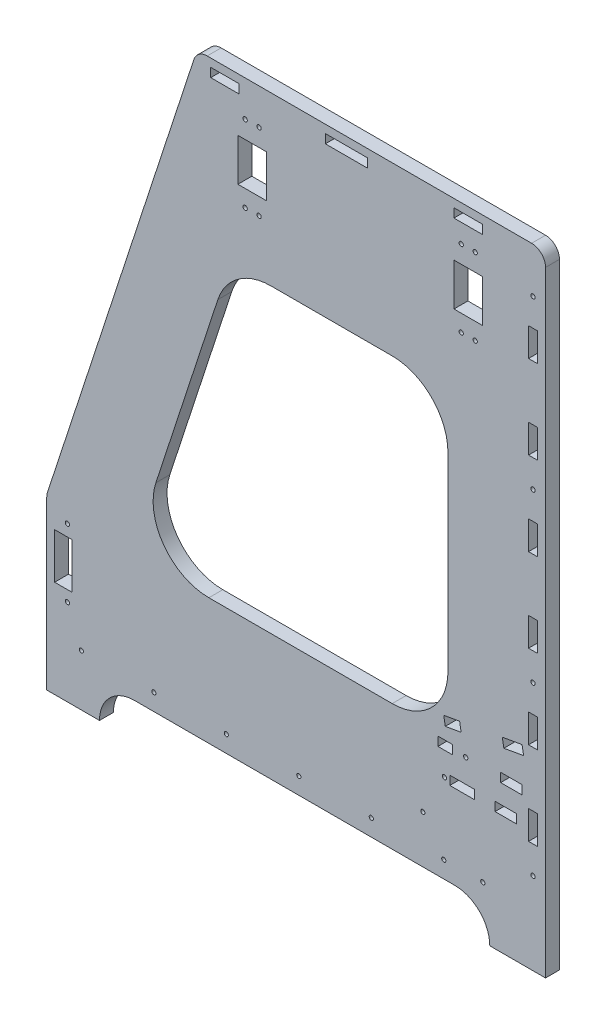
from build123d import *

# Parameters (mm, degrees)
SZKIC1_W                    = 358
SZKIC1_H                    = 451.5
DODANIE_WYCI_GNI_CIE1_DEPTH = 10
WYTNIJ_WYCI_GNI_CIE1_DEPTH  = 10
WYTNIJ_WYCI_GNI_CIE2_DEPTH  = 10
WYTNIJ_WYCI_GNI_CIE3_DEPTH  = 10
SZKIC8_W                    = 6.4
SZKIC8_H                    = 20.4
WYTNIJ_WYCI_GNI_CIE4_DEPTH  = 10
SZYK_LINIOWY1_COUNT         = 6
SZYK_LINIOWY1_PITCH         = 60
SZKIC9_R                    = 1.55
WYTNIJ_WYCI_GNI_CIE5_DEPTH  = 10
SZYK_LINIOWY2_COUNT         = 4
SZYK_LINIOWY2_PITCH         = 120
SZKIC12_W                   = 12.4
SZKIC12_H                   = 32.68
WYTNIJ_WYCI_GNI_CIE7_DEPTH  = 10
SZKIC13_R                   = 1.55
WYTNIJ_WYCI_GNI_CIE8_DEPTH  = 10
SZKIC15_R                   = 1.5
WYTNIJ_WYCI_GNI_CIE9_DEPTH  = 10
SZKIC17_R                   = 1.55
WYTNIJ_WYCI_GNI_CIE10_DEPTH = 10
SZKIC19_W                   = 20.4
SZKIC19_H                   = 6.4
SZKIC19_W_2                 = 30.4
WYTNIJ_WYCI_GNI_CIE11_DEPTH = 10
SZKIC23_R                   = 1.55
SZKIC23_W                   = 15.4
SZKIC23_H                   = 6.4
SZKIC23_W_2                 = 17.9
WYTNIJ_WYCI_GNI_CIE12_DEPTH = 10
WYTNIJ_WYCI_GNI_CIE14_DEPTH = 10
SZKIC32_R                   = 1.55
SZKIC32_W                   = 10.4
SZKIC32_H                   = 6.4
SZKIC32_W_2                 = 15.4
WYTNIJ_WYCI_GNI_CIE15_DEPTH = 10
WYTNIJ_WYCI_GNI_CIE16_DEPTH = 10
SZYK_LINIOWY3_COUNT         = 2
SZYK_LINIOWY3_PITCH         = 155
WYTNIJ_WYCI_GNI_CIE17_DEPTH = 10


with BuildPart() as part:
    # Szkic1 → Dodanie-wyciągnięcie1 (new body)
    with BuildSketch(Plane.XY.offset(-20)):
        with Locations((-429.368459045, -282.853962956)):
            Rectangle(SZKIC1_W, SZKIC1_H)
    extrude(amount=DODANIE_WYCI_GNI_CIE1_DEPTH)

    # Szkic2 → Wytnij-wyciągnięcie1 (cut)
    with BuildSketch(Plane(origin=(0, 0, -20), x_dir=(-1, 0, 0), z_dir=(0, 0, -1))):
        with BuildLine():
            Line((608.368459045, -387.603962956), (502.621218356, -63.997823625))
            ThreePointArc((502.621218356, -63.997823625), (498.986913201, -59.008859704), (493.115856793, -57.103962956))
            Line((493.115856793, -57.103962956), (500.368459045, -57.103962956))
            Line((500.368459045, -57.103962956), (608.368459045, -57.103962956))
            Line((608.368459045, -57.103962956), (608.368459045, -387.603962956))
        make_face()
    extrude(amount=-WYTNIJ_WYCI_GNI_CIE1_DEPTH, mode=Mode.SUBTRACT)

    # Szkic3 → Wytnij-wyciągnięcie2 (cut)
    with BuildSketch(Plane.XY.offset(-10)):
        with BuildLine():
            Line((-570.368459045, -508.603962956), (-290.368459045, -508.603962956))
            ThreePointArc((-290.368459045, -508.603962956), (-297.690789516, -490.926293426), (-315.368459045, -483.603962956))
            Line((-315.368459045, -483.603962956), (-545.368459045, -483.603962956))
            ThreePointArc((-545.368459045, -483.603962956), (-563.046128575, -490.926293426), (-570.368459045, -508.603962956))
        make_face()
    extrude(amount=-WYTNIJ_WYCI_GNI_CIE2_DEPTH, mode=Mode.SUBTRACT)

    # Szkic4 → Wytnij-wyciągnięcie3 (cut)
    with BuildSketch(Plane.XY.offset(-10)):
        with BuildLine():
            Line((-491.890848015, -393.103962956), (-360.368459045, -393.103962956))
            ThreePointArc((-360.368459045, -393.103962956), (-332.084187798, -381.388234203), (-320.368459045, -353.103962956))
            Line((-320.368459045, -353.103962956), (-320.368459045, -217.103962956))
            ThreePointArc((-320.368459045, -217.103962956), (-332.084187798, -188.819691708), (-360.368459045, -177.103962956))
            Line((-360.368459045, -177.103962956), (-447.449093098, -177.103962956))
            ThreePointArc((-447.449093098, -177.103962956), (-470.93331873, -184.723549949), (-485.470539353, -204.679405632))
            Line((-485.470539353, -204.679405632), (-529.91229427, -340.679405632))
            ThreePointArc((-529.91229427, -340.679405632), (-524.271261022, -376.588188587), (-491.890848015, -393.103962956))
        make_face()
    extrude(amount=-WYTNIJ_WYCI_GNI_CIE3_DEPTH, mode=Mode.SUBTRACT)

    # Szkic8 → Wytnij-wyciągnięcie4 (cut)
    with BuildSketch(Plane.XY.offset(-10)):
        with Locations((-259.368459045, -119.603962956)):
            Rectangle(SZKIC8_W, SZKIC8_H)
    wytnij_wyci_gni_cie4 = extrude(amount=-WYTNIJ_WYCI_GNI_CIE4_DEPTH, mode=Mode.SUBTRACT)

    # Szyk liniowy1: Wytnij-wyciągnięcie4 ×6
    with Locations(*[(0, -i * SZYK_LINIOWY1_PITCH, 0) for i in range(1, SZYK_LINIOWY1_COUNT)]):
        add(wytnij_wyci_gni_cie4, mode=Mode.SUBTRACT)

    # Szkic9 → Wytnij-wyciągnięcie5 (cut)
    with BuildSketch(Plane.XY.offset(-10)):
        with Locations((-259.368459045, -89.603962956)):
            Circle(SZKIC9_R)
    wytnij_wyci_gni_cie5 = extrude(amount=-WYTNIJ_WYCI_GNI_CIE5_DEPTH, mode=Mode.SUBTRACT)

    # Szyk liniowy2: Wytnij-wyciągnięcie5 ×4
    with Locations(*[(0, -i * SZYK_LINIOWY2_PITCH, 0) for i in range(1, SZYK_LINIOWY2_COUNT)]):
        add(wytnij_wyci_gni_cie5, mode=Mode.SUBTRACT)

    # Szkic12 → Wytnij-wyciągnięcie7 (cut)
    with BuildSketch(Plane.XY.offset(-10)):
        with Locations((-596.368459045, -422.463962956)):
            Rectangle(SZKIC12_W, SZKIC12_H)
    extrude(amount=-WYTNIJ_WYCI_GNI_CIE7_DEPTH, mode=Mode.SUBTRACT)

    # Szkic13 → Wytnij-wyciągnięcie8 (cut)
    with BuildSketch(Plane.XY.offset(-10)):
        with Locations((-593.368459045, -397.873962956)):
            Circle(SZKIC13_R)
        with Locations((-593.368459045, -446.553962956)):
            Circle(SZKIC13_R)
    extrude(amount=-WYTNIJ_WYCI_GNI_CIE8_DEPTH, mode=Mode.SUBTRACT)

    # Szkic15 → Wytnij-wyciągnięcie9 (cut)
    with BuildSketch(Plane.XY.offset(-10)):
        with Locations((-295.368459045, -471.603962956)):
            Circle(SZKIC15_R)
        with Locations((-323.368459045, -471.603962956)):
            Circle(SZKIC15_R)
        with Locations((-375.368459045, -471.603962956)):
            Circle(SZKIC15_R)
        with Locations((-427.368459045, -471.603962956)):
            Circle(SZKIC15_R)
        with Locations((-531.368459045, -471.603962956)):
            Circle(SZKIC15_R)
        with Locations((-479.368459045, -471.603962956)):
            Circle(SZKIC15_R)
        with Locations((-583.368459045, -471.603962956)):
            Circle(SZKIC15_R)
        with Locations((-338.368459045, -449.412668339)):
            Circle(SZKIC15_R)
    extrude(amount=-WYTNIJ_WYCI_GNI_CIE9_DEPTH, mode=Mode.SUBTRACT)

    # Szkic17 → Wytnij-wyciągnięcie10 (cut)
    with BuildSketch(Plane.XY.offset(-10)):
        with Locations((-455.868459045, -137.814883619)):
            Circle(SZKIC17_R)
        with Locations((-455.868459045, -82.814883619)):
            Circle(SZKIC17_R)
        with Locations((-465.868459045, -137.814883619)):
            Circle(SZKIC17_R)
        with Locations((-465.868459045, -82.814883619)):
            Circle(SZKIC17_R)
        Polygon((-471.068459045, -125.803962956), (-460.868459045, -125.803962956), (-450.668459045, -125.803962956), (-450.668459045, -95.403962956), (-460.868459045, -95.403962956), (-471.068459045, -95.403962956), align=None)
    wytnij_wyci_gni_cie10 = extrude(amount=-WYTNIJ_WYCI_GNI_CIE10_DEPTH, mode=Mode.SUBTRACT)

    # Szkic19 → Wytnij-wyciągnięcie11 (cut)
    with BuildSketch(Plane.XY.offset(-10)):
        with Locations((-480.368459045, -66.103962956)):
            Rectangle(SZKIC19_W, SZKIC19_H)
        with Locations((-393.118459045, -66.103962956)):
            Rectangle(SZKIC19_W_2, SZKIC19_H)
        with Locations((-305.868459045, -66.103962956)):
            Rectangle(SZKIC19_W, SZKIC19_H)
    extrude(amount=-WYTNIJ_WYCI_GNI_CIE11_DEPTH, mode=Mode.SUBTRACT)

    # Szkic23 → Wytnij-wyciągnięcie12 (cut)
    with BuildSketch(Plane.XY.offset(-10)):
        with Locations((-322.868459045, -420.103962956)):
            Circle(SZKIC23_R)
        with Locations((-278.868459045, -420.103962956)):
            Rectangle(SZKIC23_W, SZKIC23_H)
        with Locations((-310.118459045, -420.103962956)):
            Rectangle(SZKIC23_W_2, SZKIC23_H)
    extrude(amount=-WYTNIJ_WYCI_GNI_CIE12_DEPTH, mode=Mode.SUBTRACT)

    # Szkic29 → Wytnij-wyciągnięcie14 (cut)
    with BuildSketch(Plane.XY.offset(-10)):
        Polygon((-323.403118877, -381.907994616), (-322.29177054, -388.210764235), (-310.89994388, -386.202077835), (-312.011292217, -379.899308216), align=None)
        Polygon((-281.383771099, -374.498849891), (-280.272422762, -380.80161951), (-266.091191118, -378.301085752), (-267.202539455, -371.998316132), align=None)
    extrude(amount=-WYTNIJ_WYCI_GNI_CIE14_DEPTH, mode=Mode.SUBTRACT)

    # Szkic32 → Wytnij-wyciągnięcie15 (cut)
    with BuildSketch(Plane.XY.offset(-10)):
        with Locations((-307.650240695, -400.103962956)):
            Circle(SZKIC32_R)
        with Locations((-322.368459045, -400.103962956)):
            Rectangle(SZKIC32_W, SZKIC32_H)
        with Locations((-274.868459045, -400.103962956)):
            Rectangle(SZKIC32_W_2, SZKIC32_H)
    extrude(amount=-WYTNIJ_WYCI_GNI_CIE15_DEPTH, mode=Mode.SUBTRACT)

    # Szkic34 → Wytnij-wyciągnięcie16 (cut)
    with BuildSketch(Plane(origin=(0, 0, -20), x_dir=(-1, 0, 0), z_dir=(0, 0, -1))):
        with BuildLine():
            Line((607.281290895, -383.676301549), (608.368459045, -387.603962956))
            Line((608.368459045, -387.603962956), (608.368459045, -391.679310636))
            ThreePointArc((608.368459045, -391.679310636), (608.095424544, -387.641053306), (607.281290895, -383.676301549))
        make_face()
    extrude(amount=-WYTNIJ_WYCI_GNI_CIE16_DEPTH, mode=Mode.SUBTRACT)

    # Szyk liniowy3: Wytnij-wyciągnięcie10 ×2
    with Locations(*[(i * SZYK_LINIOWY3_PITCH, 0, 0) for i in range(1, SZYK_LINIOWY3_COUNT)]):
        add(wytnij_wyci_gni_cie10, mode=Mode.SUBTRACT)

    # Szkic35 → Wytnij-wyciągnięcie17 (cut)
    with BuildSketch(Plane.XY.offset(-10)):
        with BuildLine():
            Line((-260.368459045, -57.103962956), (-250.368459045, -57.103962956))
            Line((-250.368459045, -57.103962956), (-250.368459045, -67.103962956))
            ThreePointArc((-250.368459045, -67.103962956), (-253.297391233, -60.032895144), (-260.368459045, -57.103962956))
        make_face()
    extrude(amount=-WYTNIJ_WYCI_GNI_CIE17_DEPTH, mode=Mode.SUBTRACT)


solid = part.part
